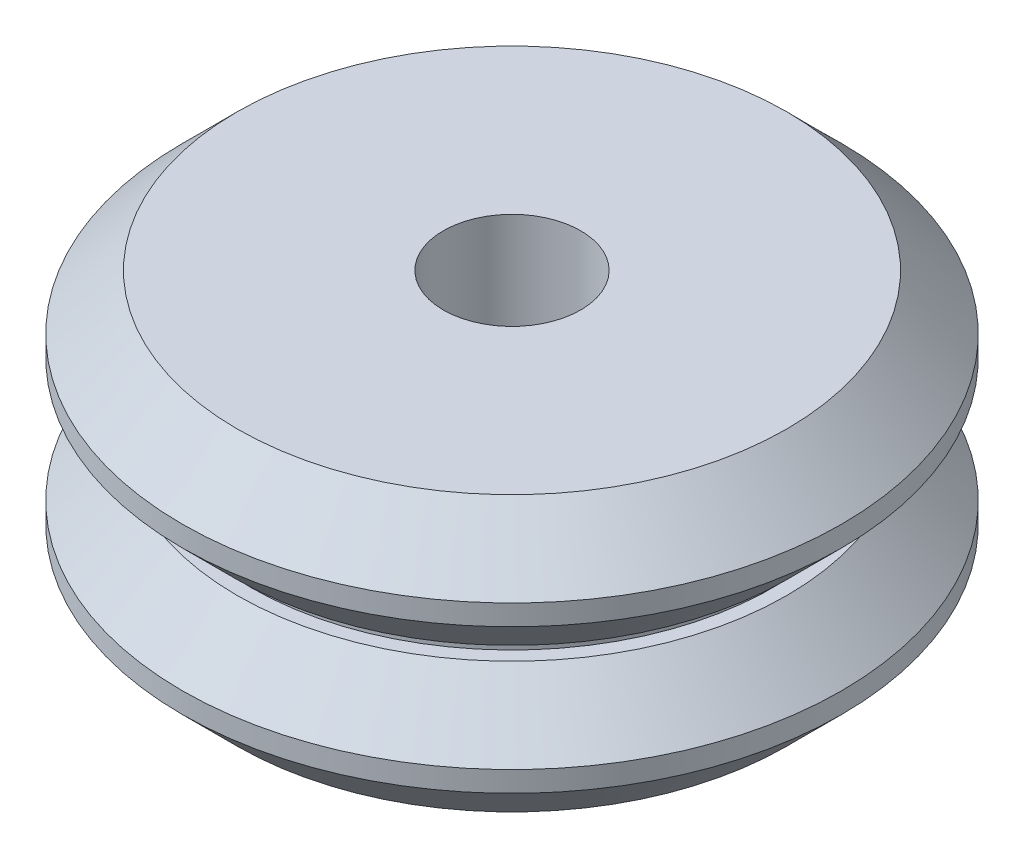
from build123d import *

# Parameters (mm, degrees)
SKETCH_1_W          = 9.5
SKETCH_1_H          = 0.5
SKETCH_2_R          = 2.5
CUT_EXTRUDE_1_DEPTH = 20.697715604


with BuildPart() as part:
    # 草图1 → 旋转1 (revolve)
    with BuildSketch(Plane.XY, mode=Mode.PRIVATE) as revolve_1_sk:
        Polygon((10, 5), (0, 5), (0, 0.25), (9.5, 0.25), (10, 0.25), (12, 2.25), (12, 3), align=None)
        Polygon((9.5, -0.25), (0, -0.25), (0, -5), (10, -5), (12, -3), (12, -2.25), (10, -0.25), align=None)
        with Locations((4.75, 0)):
            Rectangle(SKETCH_1_W, SKETCH_1_H)
    revolve(revolve_1_sk.sketch.rotate(Axis((0, 5, 0), (0, -1, 0)), 90), axis=Axis((0, 5, 0), (0, -1, 0)))

    # 草图2 → 切除-拉伸1 (cut, through all)
    with BuildSketch(Plane(origin=(0, 5, 0), x_dir=(1, 0, 0), z_dir=(0, 1, 0))):
        with Locations(Location((0, 0, 0), (0, 0, 270))):
            Circle(SKETCH_2_R)
    extrude(amount=-CUT_EXTRUDE_1_DEPTH, mode=Mode.SUBTRACT)


solid = part.part
